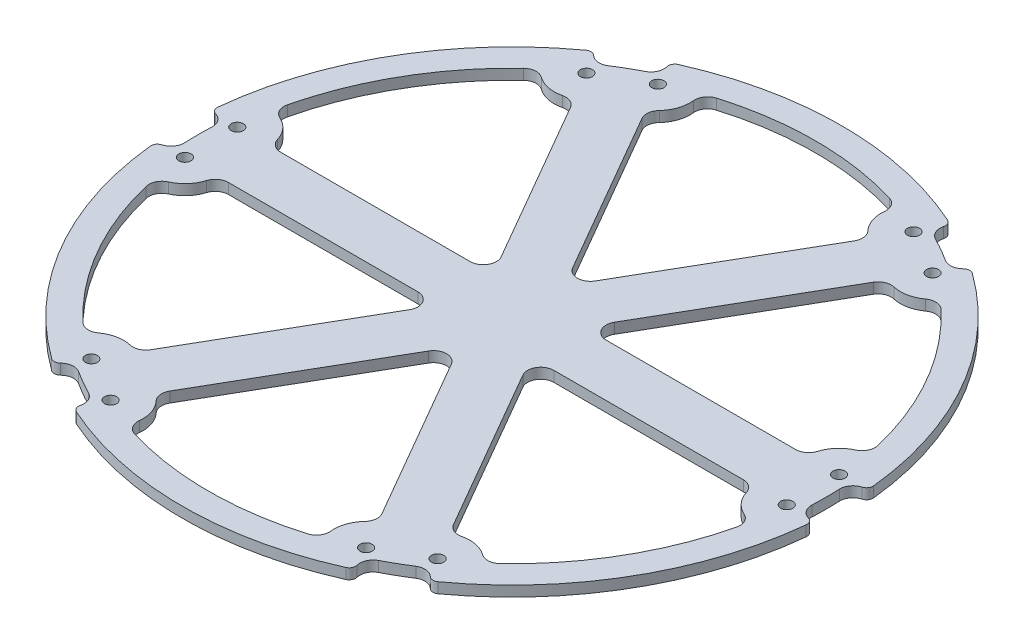
from build123d import *

# Parameters (mm, degrees)
SKETCH1_R                             = 76.2
BOSS_EXTRUDE1_DEPTH                   = 2.54
CUTOUTFILLER_START                    = -2.54
CUTOUTFILLER_DEPTH                    = 2.54
QUARTERENDMILLFILLET_R                = 3.175
HANDLINGFILLET_R                      = 1.5875
CUT_EXTRUDE1_DEPTH                    = 111.51919169
FILLET7_R                             = 3.175
CIRPATTERN5_COUNT                     = 6
QUARTERENDMILLFILLET_OF_CIRPATTERN5_R = 3.175
HANDLINGFILLET_OF_CIRPATTERN5_R       = 1.5875
FILLET7_OF_CIRPATTERN5_R              = 3.175
F_4_CLEARANCE_HOLE1_D                 = 2.9464
BOSS_EXTRUDE3_DEPTH                   = 2.54
CIRPATTERN6_COUNT                     = 6
FILLET8_R                             = 3.175


with BuildPart() as part:
    # Sketch1 → Boss-Extrude1 (new body)
    with BuildSketch(Plane(origin=(0, 0, 0), x_dir=(1, 0, 0), z_dir=(0, 1, 0))):
        with Locations(Location((0, 0, 0), (0, 0, 270))):
            Circle(SKETCH1_R)
    extrude(amount=BOSS_EXTRUDE1_DEPTH)

    # Sketch2 → cutoutFiller (add)
    with BuildSketch(Plane(origin=(0, 2.54, 0), x_dir=(1, 0, 0), z_dir=(0, 1, 0)).offset(CUTOUTFILLER_START)):
        with BuildLine():
            Line((-32.468216545, 68.936600688), (-34.091627373, 72.383430722))
            ThreePointArc((-34.091627373, 72.383430722), (0, 80.01), (34.091627373, 72.383430722))
            Line((34.091627373, 72.383430722), (32.468216545, 68.936600688))
            ThreePointArc((32.468216545, 68.936600688), (0, 76.2), (-32.468216545, 68.936600688))
        make_face()
    cutoutfiller = extrude(amount=CUTOUTFILLER_DEPTH)

    # quarterEndmillFillet
    quarterendmillfillet_edges = [part.edges().sort_by_distance(p)[0] for p in [
        (32.468216545, 1.27, -68.936600688),
        (-32.468216545, 1.27, -68.936600688),
    ]]
    fillet(quarterendmillfillet_edges, radius=QUARTERENDMILLFILLET_R)

    # handlingFillet
    handlingfillet_edges = [part.edges().sort_by_distance(p)[0] for p in [
        (-34.091627373, 1.27, -72.383430722),
        (34.091627373, 1.27, -72.383430722),
    ]]
    fillet(handlingfillet_edges, radius=HANDLINGFILLET_R)

    # Sketch4 → Cut-Extrude1 (cut, symmetric)
    with BuildSketch(Plane.XZ):
        with BuildLine():
            Line((-6.35, -23.698522628), (-29.615182812, -63.995001306))
            ThreePointArc((-29.615182812, -63.995001306), (-28.194852148, -66.044412248), (-27.355072953, -68.392218737))
            ThreePointArc((-27.355072953, -68.392218737), (-17.036487488, -71.662777605), (-6.35, -73.385782683))
            ThreePointArc((-6.35, -73.385782683), (0, -73.66), (6.35, -73.385782683))
            ThreePointArc((6.35, -73.385782683), (17.036487488, -71.662777605), (27.355072953, -68.392218737))
            ThreePointArc((27.355072953, -68.392218737), (28.194852148, -66.044412248), (29.615182812, -63.995001306))
            Line((29.615182812, -63.995001306), (6.35, -23.698522628))
            Line((6.35, -23.698522628), (0, -12.7))
            Line((0, -12.7), (-6.35, -23.698522628))
        make_face()
    cut_extrude1 = extrude(amount=CUT_EXTRUDE1_DEPTH, both=True, mode=Mode.SUBTRACT)

    # Fillet7
    fillet7_edges = [part.edges().sort_by_distance(p)[0] for p in [
        (0, 1.27, -12.7),
        (27.355072953, 1.27, -68.392218737),
        (29.615182812, 1.27, -63.995001306),
        (-29.615182812, 1.27, -63.995001306),
        (-27.355072953, 1.27, -68.392218737),
    ]]
    fillet(fillet7_edges, radius=FILLET7_R)

    # CirPattern5: cutoutFiller, Cut-Extrude1 ×6 about axis
    cirpattern5_axis = Axis((0, 0, 0), (0, 1, 0))
    add([cutoutfiller.rotate(cirpattern5_axis, i * 360 / CIRPATTERN5_COUNT) for i in range(1, CIRPATTERN5_COUNT)])
    add([cut_extrude1.rotate(cirpattern5_axis, i * 360 / CIRPATTERN5_COUNT) for i in range(1, CIRPATTERN5_COUNT)], mode=Mode.SUBTRACT)

    # quarterEndmillFillet of CirPattern5
    quarterendmillfillet_of_cirpattern5_edges = [part.edges().sort_by_distance(p)[0] for p in [
        (-43.466739173, 1.27, -62.586600688),
        (-75.934955719, 1.27, -6.35),
        (-75.934955719, 1.27, 6.35),
        (-43.466739173, 1.27, 62.586600688),
        (-32.468216545, 1.27, 68.936600688),
        (32.468216545, 1.27, 68.936600688),
        (43.466739173, 1.27, 62.586600688),
        (75.934955719, 1.27, 6.35),
        (75.934955719, 1.27, -6.35),
        (43.466739173, 1.27, -62.586600688),
    ]]
    fillet(quarterendmillfillet_of_cirpattern5_edges, radius=QUARTERENDMILLFILLET_OF_CIRPATTERN5_R)

    # handlingFillet of CirPattern5
    handlingfillet_of_cirpattern5_edges = [part.edges().sort_by_distance(p)[0] for p in [
        (-79.731703505, 1.27, -6.6675),
        (-45.640076132, 1.27, -65.715930722),
        (-45.640076132, 1.27, 65.715930722),
        (-79.731703505, 1.27, 6.6675),
        (34.091627373, 1.27, 72.383430722),
        (-34.091627373, 1.27, 72.383430722),
        (79.731703505, 1.27, 6.6675),
        (45.640076132, 1.27, 65.715930722),
        (45.640076132, 1.27, -65.715930722),
        (79.731703505, 1.27, -6.6675),
    ]]
    fillet(handlingfillet_of_cirpattern5_edges, radius=HANDLINGFILLET_OF_CIRPATTERN5_R)

    # Fillet7 of CirPattern5
    fillet7_of_cirpattern5_edges = [part.edges().sort_by_distance(p)[0] for p in [
        (-10.998522628, 1.27, -6.35),
        (-45.551862371, 1.27, -57.886297468),
        (-40.61370544, 1.27, -57.645001306),
        (-70.228888252, 1.27, -6.35),
        (-72.906935324, 1.27, -10.505921269),
        (-10.998522628, 1.27, 6.35),
        (-72.906935324, 1.27, 10.505921269),
        (-70.228888252, 1.27, 6.35),
        (-40.61370544, 1.27, 57.645001306),
        (-45.551862371, 1.27, 57.886297468),
        (0, 1.27, 12.7),
        (-27.355072953, 1.27, 68.392218737),
        (-29.615182812, 1.27, 63.995001306),
        (29.615182812, 1.27, 63.995001306),
        (27.355072953, 1.27, 68.392218737),
        (10.998522628, 1.27, 6.35),
        (45.551862371, 1.27, 57.886297468),
        (40.61370544, 1.27, 57.645001306),
        (70.228888252, 1.27, 6.35),
        (72.906935324, 1.27, 10.505921269),
        (10.998522628, 1.27, -6.35),
        (72.906935324, 1.27, -10.505921269),
        (70.228888252, 1.27, -6.35),
        (40.61370544, 1.27, -57.645001306),
        (45.551862371, 1.27, -57.886297468),
    ]]
    fillet(fillet7_of_cirpattern5_edges, radius=FILLET7_OF_CIRPATTERN5_R)

    # #4 Clearance Hole1 (through all)
    with Locations(Plane(origin=(0, 0, 0), x_dir=(-1, 0, 0), z_dir=(0, -1, 0))):
        with Locations((73.025, 6.35), (73.025, -6.35)):
            f_4_clearance_hole1 = Hole(F_4_CLEARANCE_HOLE1_D / 2)

    # Sketch7 → Boss-Extrude3 (add)
    with BuildSketch(Plane(origin=(0, 2.54, 0), x_dir=(1, 0, 0), z_dir=(0, 1, 0))):
        with BuildLine():
            Line((-73.025, 14.1732), (-73.025, 7.8232))
            ThreePointArc((-73.025, 7.8232), (-71.5518, 6.35), (-73.025, 4.8768))
            Line((-73.025, 4.8768), (-73.025, -4.8768))
            ThreePointArc((-73.025, -4.8768), (-71.5518, -6.35), (-73.025, -7.8232))
            Line((-73.025, -7.8232), (-73.025, -14.1732))
            ThreePointArc((-73.025, -14.1732), (-65.579203258, -8.750535174), (-68.455540706, 0))
            ThreePointArc((-68.455540706, 0), (-65.579203258, 8.750535174), (-73.025, 14.1732))
        make_face()
    boss_extrude3 = extrude(amount=-BOSS_EXTRUDE3_DEPTH)

    # CirPattern6: #4 Clearance Hole1, Boss-Extrude3 ×6 about axis
    cirpattern6_axis = Axis((0, 0, 0), (0, 1, 0))
    add([f_4_clearance_hole1.rotate(cirpattern6_axis, i * 360 / CIRPATTERN6_COUNT) for i in range(1, CIRPATTERN6_COUNT)], mode=Mode.SUBTRACT)
    add([boss_extrude3.rotate(cirpattern6_axis, i * 360 / CIRPATTERN6_COUNT) for i in range(1, CIRPATTERN6_COUNT)])

    # Fillet8
    fillet8_edges = [part.edges().sort_by_distance(p)[0] for p in [
        (-72.290350381, 1.27, -14.138629416),
        (-65.2018, 1.27, -6.35),
        (-65.2018, 1.27, 6.35),
        (-72.290350381, 1.27, 14.138629416),
        (-48.389587439, 1.27, 55.535965171),
        (-38.100161314, 1.27, 53.291415172),
        (-27.101638686, 1.27, 59.641415172),
        (-23.900762942, 1.27, 69.674594587),
        (23.900762942, 1.27, 69.674594587),
        (27.101638686, 1.27, 59.641415172),
        (38.100161314, 1.27, 53.291415172),
        (48.389587439, 1.27, 55.535965171),
        (72.290350381, 1.27, 14.138629416),
        (65.2018, 1.27, 6.35),
        (65.2018, 1.27, -6.35),
        (72.290350381, 1.27, -14.138629416),
        (48.389587439, 1.27, -55.535965171),
        (38.100161314, 1.27, -53.291415172),
        (27.101638686, 1.27, -59.641415172),
        (23.900762942, 1.27, -69.674594587),
        (-23.900762942, 1.27, -69.674594587),
        (-27.101638686, 1.27, -59.641415172),
        (-38.100161314, 1.27, -53.291415172),
        (-48.389587439, 1.27, -55.535965171),
    ]]
    fillet(fillet8_edges, radius=FILLET8_R)


solid = part.part
